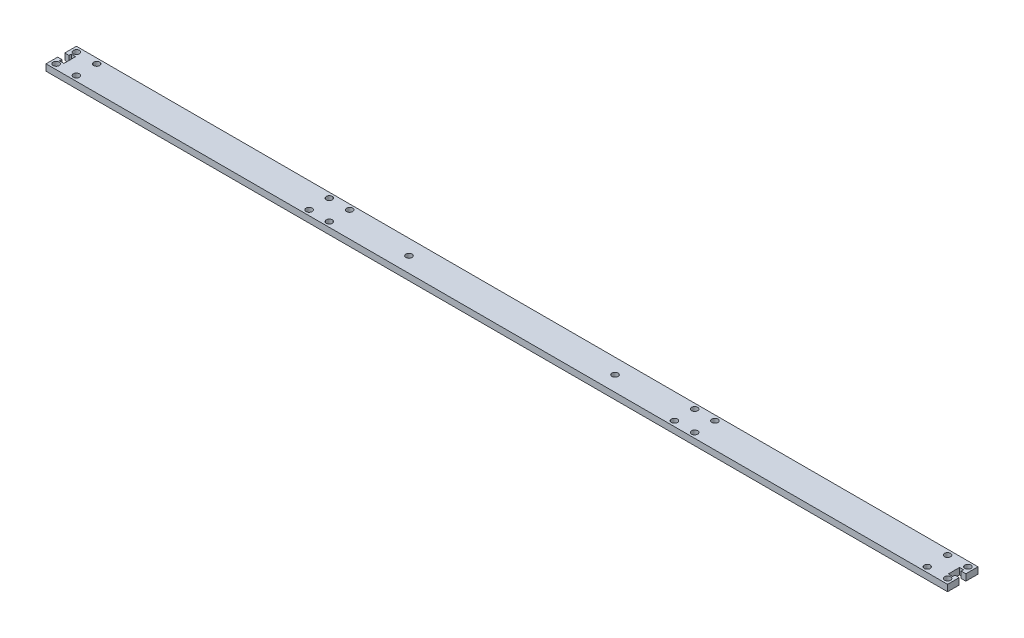
from build123d import *

# Parameters (mm, degrees)
SKETCH1_R           = 1.5
BOSS_EXTRUDE1_DEPTH = 3.175
CUT_EXTRUDE2_DEPTH  = 10
SKETCH6_W           = 2.65
SKETCH6_H           = 3.175
CUT_EXTRUDE3_DEPTH  = 0.25


with BuildPart() as part:
    # Sketch1 → Boss-Extrude1 (new body)
    with BuildSketch(Plane(origin=(0, 0, 0), x_dir=(1, 0, 0), z_dir=(0, 1, 0))):
        Polygon((0, 7.5), (0, 0), (444.5, 0), (444.5, 15), (0, 15), align=None)
        with Locations(Location((2.5, 2.5, 0), (0, 0, 270))):
            Circle(SKETCH1_R, mode=Mode.SUBTRACT)
        with Locations(Location((12.5, 2.5, 0), (0, 0, 270))):
            Circle(SKETCH1_R, mode=Mode.SUBTRACT)
        with Locations(Location((127.2, 2.5, 0), (0, 0, 270))):
            Circle(SKETCH1_R, mode=Mode.SUBTRACT)
        with Locations(Location((137.2, 2.5, 0), (0, 0, 270))):
            Circle(SKETCH1_R, mode=Mode.SUBTRACT)
        with Locations(Location((2.5, 12.5, 0), (0, 0, 270))):
            Circle(SKETCH1_R, mode=Mode.SUBTRACT)
        with Locations(Location((12.5, 12.5, 0), (0, 0, 270))):
            Circle(SKETCH1_R, mode=Mode.SUBTRACT)
        with Locations(Location((127.2, 12.5, 0), (0, 0, 270))):
            Circle(SKETCH1_R, mode=Mode.SUBTRACT)
        with Locations(Location((137.2, 12.5, 0), (0, 0, 270))):
            Circle(SKETCH1_R, mode=Mode.SUBTRACT)
        with Locations(Location((171.45, 7.5, 0), (0, 0, 270))):
            Circle(SKETCH1_R, mode=Mode.SUBTRACT)
        with Locations(Location((273.05, 7.5, 0), (0, 0, 270))):
            Circle(SKETCH1_R, mode=Mode.SUBTRACT)
        with Locations(Location((442, 12.5, 0), (0, 0, 270))):
            Circle(SKETCH1_R, mode=Mode.SUBTRACT)
        with Locations(Location((307.3, 2.5, 0), (0, 0, 270))):
            Circle(SKETCH1_R, mode=Mode.SUBTRACT)
        with Locations(Location((317.3, 2.5, 0), (0, 0, 270))):
            Circle(SKETCH1_R, mode=Mode.SUBTRACT)
        with Locations(Location((432, 2.5, 0), (0, 0, 270))):
            Circle(SKETCH1_R, mode=Mode.SUBTRACT)
        with Locations(Location((442, 2.5, 0), (0, 0, 270))):
            Circle(SKETCH1_R, mode=Mode.SUBTRACT)
        with Locations(Location((307.3, 12.5, 0), (0, 0, 270))):
            Circle(SKETCH1_R, mode=Mode.SUBTRACT)
        with Locations(Location((317.3, 12.5, 0), (0, 0, 270))):
            Circle(SKETCH1_R, mode=Mode.SUBTRACT)
        with Locations(Location((432, 12.5, 0), (0, 0, 270))):
            Circle(SKETCH1_R, mode=Mode.SUBTRACT)
    extrude(amount=BOSS_EXTRUDE1_DEPTH)

    # Sketch4 → Cut-Extrude2 (cut)
    with BuildSketch(Plane(origin=(0, 3.175, 0), x_dir=(1, 0, 0), z_dir=(0, 1, 0))):
        Polygon((444.5, 5.75), (444.5, 7.5), (440.5, 7.5), (440.25, 7.5), (440.25, 4.6), (442.45, 4.6), (442.45, 5.75), align=None)
        Polygon((440.5, 7.5), (444.5, 7.5), (444.5, 9), (442.2, 9), (442.2, 10.15), (440.5, 10.15), align=None)
        Polygon((2.05, 9.25), (0, 9.25), (0, 5.75), (2.05, 5.75), (2.05, 4.6), (4.25, 4.6), (4.25, 7.5), (4.25, 10.4), (2.05, 10.4), align=None)
    extrude(amount=-CUT_EXTRUDE2_DEPTH, mode=Mode.SUBTRACT)

    # Sketch6 → Cut-Extrude3 (cut)
    with BuildSketch(Plane(origin=(440.5, 0, 0), x_dir=(0, 0, -1), z_dir=(1, 0, 0))):
        with Locations((8.825, 1.5875)):
            Rectangle(SKETCH6_W, SKETCH6_H)
    extrude(amount=-CUT_EXTRUDE3_DEPTH, mode=Mode.SUBTRACT)


solid = part.part
